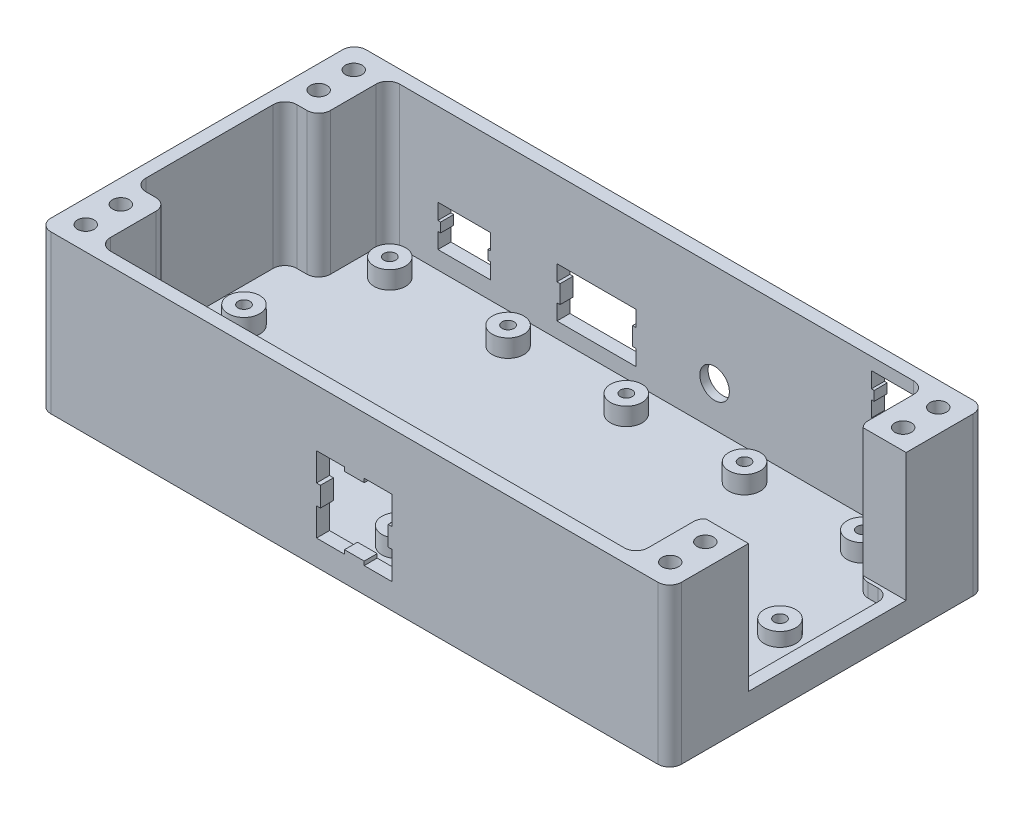
from build123d import *

# Parameters (mm, degrees)
EXTRUDE_1_DEPTH            = 40
CUT_EXTRUDE_1_DEPTH        = 36
EXTRUDE_2_DEPTH            = 36
SKETCH_4_R                 = 2.1
CUT_EXTRUDE_2_DEPTH        = 98.979589711
SKETCH_5_R                 = 4
SKETCH_5_R_2               = 1.5
EXTRUDE_3_DEPTH            = 4.5
PATTERN_LINEAR_1_COUNT     = 3
PATTERN_LINEAR_1_PITCH     = 30
PATTERN_LINEAR_1_COL_COUNT = 3
PATTERN_LINEAR_1_COL_PITCH = 30
SKETCH_6_R                 = 4
SKETCH_6_R_2               = 1.5
EXTRUDE_4_DEPTH            = 4.5
FILLET_1_R                 = 3
SKETCH_7_W                 = 40
SKETCH_7_H                 = 40
CUT_EXTRUDE_3_DEPTH        = 25
CUT_EXTRUDE_4_DEPTH        = 10
SKETCH_9_R                 = 3.75
CUT_EXTRUDE_5_DEPTH        = 3.3
SKETCH_10_R                = 6
CUT_EXTRUDE_6_DEPTH        = 1.2
CUT_EXTRUDE_7_REACH        = 122


with BuildPart() as part:
    # Эскиз1 → Бобышка-Вытянуть1 (new body)
    with BuildSketch(Plane(origin=(0, 0, 0), x_dir=(1, 0, 0), z_dir=(0, 1, 0))):
        with BuildLine():
            Line((-77, -40), (77, -40))
            ThreePointArc((77, -40), (79.121320344, -39.121320344), (80, -37))
            Line((80, -37), (80, 37))
            ThreePointArc((80, 37), (79.121320344, 39.121320344), (77, 40))
            Line((77, 40), (-77, 40))
            ThreePointArc((-77, 40), (-79.121320344, 39.121320344), (-80, 37))
            Line((-80, 37), (-80, -37))
            ThreePointArc((-80, -37), (-79.121320344, -39.121320344), (-77, -40))
        make_face()
    extrude(amount=EXTRUDE_1_DEPTH)

    # Эскиз2 → Вырез-Вытянуть1 (cut)
    with BuildSketch(Plane(origin=(0, 40, 0), x_dir=(1, 0, 0), z_dir=(0, 1, 0))):
        with BuildLine():
            Line((-75.75, -36.7), (75.75, -36.7))
            ThreePointArc((75.75, -36.7), (76.457106781, -36.407106781), (76.75, -35.7))
            Line((76.75, -35.7), (76.75, 35.7))
            ThreePointArc((76.75, 35.7), (76.457106781, 36.407106781), (75.75, 36.7))
            Line((75.75, 36.7), (-75.75, 36.7))
            ThreePointArc((-75.75, 36.7), (-76.457106781, 36.407106781), (-76.75, 35.7))
            Line((-76.75, 35.7), (-76.75, -35.7))
            ThreePointArc((-76.75, -35.7), (-76.457106781, -36.407106781), (-75.75, -36.7))
        make_face()
    extrude(amount=-CUT_EXTRUDE_1_DEPTH, mode=Mode.SUBTRACT)

    # Эскиз3 → Бобышка-Вытянуть2 (add)
    with BuildSketch(Plane(origin=(0, 4, 0), x_dir=(1, 0, 0), z_dir=(0, 1, 0))):
        with BuildLine():
            Line((-76.75, -36.7), (-68.2, -36.7))
            Line((-68.2, -36.7), (-68.2, -22.15))
            ThreePointArc((-68.2, -22.15), (-69.078679656, -20.028679656), (-71.2, -19.15))
            Line((-71.2, -19.15), (-76.75, -19.15))
            Line((-76.75, -19.15), (-76.75, -36.7))
        make_face()
        with BuildLine():
            Line((-68.2, 36.7), (-68.2, 22.15))
            ThreePointArc((-68.2, 22.15), (-69.078679656, 20.028679656), (-71.2, 19.15))
            Line((-71.2, 19.15), (-76.75, 19.15))
            Line((-76.75, 19.15), (-76.75, 36.7))
            Line((-76.75, 36.7), (-68.2, 36.7))
        make_face()
        with BuildLine():
            Line((76.75, 36.7), (68.2, 36.7))
            Line((68.2, 36.7), (68.2, 22.15))
            ThreePointArc((68.2, 22.15), (69.078679656, 20.028679656), (71.2, 19.15))
            Line((71.2, 19.15), (76.75, 19.15))
            Line((76.75, 19.15), (76.75, 36.7))
        make_face()
        with BuildLine():
            Line((68.2, -36.7), (68.2, -22.15))
            ThreePointArc((68.2, -22.15), (69.078679656, -20.028679656), (71.2, -19.15))
            Line((71.2, -19.15), (76.75, -19.15))
            Line((76.75, -19.15), (76.75, -36.7))
            Line((76.75, -36.7), (68.2, -36.7))
        make_face()
    extrude(amount=EXTRUDE_2_DEPTH)

    # Эскиз4 → Вырез-Вытянуть2 (cut, through all)
    with BuildSketch(Plane(origin=(0, 40, 0), x_dir=(1, 0, 0), z_dir=(0, 1, 0))):
        with Locations(Location((-74.15, -34, 0), (0, 0, 270))):
            Circle(SKETCH_4_R)
        with Locations(Location((-74.15, 34, 0), (0, 0, 90))):
            Circle(SKETCH_4_R)
        with Locations(Location((74.15, 34, 0), (0, 0, 270))):
            Circle(SKETCH_4_R)
        with Locations(Location((74.15, -34, 0), (0, 0, 90))):
            Circle(SKETCH_4_R)
        with Locations(Location((-74.15, -25.1, 0), (0, 0, 270))):
            Circle(SKETCH_4_R)
        with Locations(Location((-74.15, 25.1, 0), (0, 0, 90))):
            Circle(SKETCH_4_R)
        with Locations(Location((74.15, 25.1, 0), (0, 0, 270))):
            Circle(SKETCH_4_R)
        with Locations(Location((74.15, -25.1, 0), (0, 0, 90))):
            Circle(SKETCH_4_R)
    extrude(amount=-CUT_EXTRUDE_2_DEPTH, mode=Mode.SUBTRACT)

    # Эскиз5 → Бобышка-Вытянуть3 (add)
    # profile 1 of 2: a face of its own
    with BuildSketch(Plane(origin=(0, 4, 0), x_dir=(1, 0, 0), z_dir=(0, 1, 0))):
        with Locations(Location((0, -29, 0), (0, 0, 90))):
            Circle(SKETCH_5_R)
        with Locations(Location((0, -29, 0), (0, 0, 270))):
            Circle(SKETCH_5_R_2, mode=Mode.SUBTRACT)
    # profile 2 of 2: a face of its own
    with BuildSketch(Plane(origin=(0, 4, 0), x_dir=(1, 0, 0), z_dir=(0, 1, 0))):
        with Locations(Location((0, 29, 0), (0, 0, 90))):
            Circle(SKETCH_5_R)
        with Locations(Location((0, 29, 0), (0, 0, 270))):
            Circle(SKETCH_5_R_2, mode=Mode.SUBTRACT)
    extrude_3 = extrude(amount=EXTRUDE_3_DEPTH)

    # Линейный массив1: Бобышка-Вытянуть3 ×3
    with Locations(*[(i * PATTERN_LINEAR_1_PITCH, 0, 0) for i in range(1, PATTERN_LINEAR_1_COUNT)]):
        add(extrude_3)

    # Линейный массив1 col: Бобышка-Вытянуть3 ×3
    with Locations(*[(-i * PATTERN_LINEAR_1_COL_PITCH, 0, 0) for i in range(1, PATTERN_LINEAR_1_COL_COUNT)]):
        add(extrude_3)

    # Эскиз6 → Бобышка-Вытянуть4 (add)
    # profile 1 of 2: a face of its own
    with BuildSketch(Plane(origin=(0, 4, 0), x_dir=(1, 0, 0), z_dir=(0, 1, 0))):
        with Locations(Location((-68, 0, 0), (0, 0, 90))):
            Circle(SKETCH_6_R)
        with Locations(Location((-68, 0, 0), (0, 0, 270))):
            Circle(SKETCH_6_R_2, mode=Mode.SUBTRACT)
    # profile 2 of 2: a face of its own
    with BuildSketch(Plane(origin=(0, 4, 0), x_dir=(1, 0, 0), z_dir=(0, 1, 0))):
        with Locations(Location((68, 0, 0), (0, 0, 90))):
            Circle(SKETCH_6_R)
        with Locations(Location((68, 0, 0), (0, 0, 90))):
            Circle(SKETCH_6_R_2, mode=Mode.SUBTRACT)
    extrude(amount=EXTRUDE_4_DEPTH)

    # Скругление1
    fillet_1_edges = [part.edges().sort_by_distance(p)[0] for p in [
        (68.2, 22, 36.7),
        (76.75, 22, 19.15),
        (-76.75, 22, 19.15),
        (-68.2, 22, 36.7),
        (-68.2, 22, -36.7),
        (-76.75, 22, -19.15),
        (76.75, 22, -19.15),
        (68.2, 22, -36.7),
    ]]
    fillet(fillet_1_edges, radius=FILLET_1_R)

    # Эскиз7 → Вырез-Вытянуть3 (cut)
    with BuildSketch(Plane(origin=(80, 0, 0), x_dir=(0, 0, -1), z_dir=(1, 0, 0))):
        with Locations((0, 27.5)):
            Rectangle(SKETCH_7_W, SKETCH_7_H)
    extrude(amount=-CUT_EXTRUDE_3_DEPTH, mode=Mode.SUBTRACT)

    # Эскиз8 → Вырез-Вытянуть4 (cut)
    with BuildSketch(Plane(origin=(0, 0, -40), x_dir=(-1, 0, 0), z_dir=(0, 0, -1))):
        Polygon((-54.5, 18.9), (-67.9, 18.9), (-67.9, 14.9), (-67.2, 14.9), (-67.2, 12.5), (-67.9, 12.5), (-67.9, 8.5), (-54.5, 8.5), (-54.5, 12.5), (-55.2, 12.5), (-55.2, 14.9), (-54.5, 14.9), align=None)
        Polygon((55.5, 18.9), (42.1, 18.9), (42.1, 14.9), (42.8, 14.9), (42.8, 12.5), (42.1, 12.5), (42.1, 8.5), (55.5, 8.5), (55.5, 12.5), (54.8, 12.5), (54.8, 14.9), (55.5, 14.9), align=None)
        Polygon((-54.5, 36.9), (-67.9, 36.9), (-67.9, 32.9), (-67.2, 32.9), (-67.2, 30.5), (-67.9, 30.5), (-67.9, 26.5), (-54.5, 26.5), (-54.5, 30.5), (-55.2, 30.5), (-55.2, 32.9), (-54.5, 32.9), align=None)
    extrude(amount=-CUT_EXTRUDE_4_DEPTH, mode=Mode.SUBTRACT)

    # Эскиз9 → Вырез-Вытянуть5 (cut)
    with BuildSketch(Plane(origin=(0, 0, -40), x_dir=(-1, 0, 0), z_dir=(0, 0, -1))):
        with Locations((-14.7, 14.2)):
            Circle(SKETCH_9_R)
        Polygon((5.3, 20.5), (25.3, 20.5), (25.3, 16.5), (24.5, 16.5), (24.5, 11.9), (25.3, 11.9), (25.3, 7.9), (5.3, 7.9), (5.3, 11.9), (6.1, 11.9), (6.1, 16.5), (5.3, 16.5), align=None)
    extrude(amount=-CUT_EXTRUDE_5_DEPTH, mode=Mode.SUBTRACT)

    # Эскиз10 → Вырез-Вытянуть6 (cut)
    with BuildSketch(Plane(origin=(0, 0, -40), x_dir=(-1, 0, 0), z_dir=(0, 0, -1))):
        with Locations((-14.7, 14.2)):
            Circle(SKETCH_10_R)
    extrude(amount=-CUT_EXTRUDE_6_DEPTH, mode=Mode.SUBTRACT)

    # Эскиз11 → Вырез-Вытянуть7 (cut, up to next)
    with BuildSketch(Plane.XY.offset(40), mode=Mode.PRIVATE) as cut_extrude_7_sk1:
        Polygon((-9.6, 25.6), (-2.5, 25.6), (-2.5, 24.6), (2.5, 24.6), (2.5, 25.6), (9.6, 25.6), (9.6, 18.5), (8.6, 18.5), (8.6, 13.5), (9.6, 13.5), (9.6, 6.4), (2.5, 6.4), (2.5, 7.4), (-2.5, 7.4), (-2.5, 6.4), (-9.6, 6.4), (-9.6, 13.5), (-8.6, 13.5), (-8.6, 18.5), (-9.6, 18.5), align=None)
    cut_extrude_7_tool1 = extrude(cut_extrude_7_sk1.sketch, amount=-CUT_EXTRUDE_7_REACH, mode=Mode.PRIVATE) & part.part
    add(cut_extrude_7_tool1.solids().sort_by_distance((0, 16, 40))[0], mode=Mode.SUBTRACT)


solid = part.part
